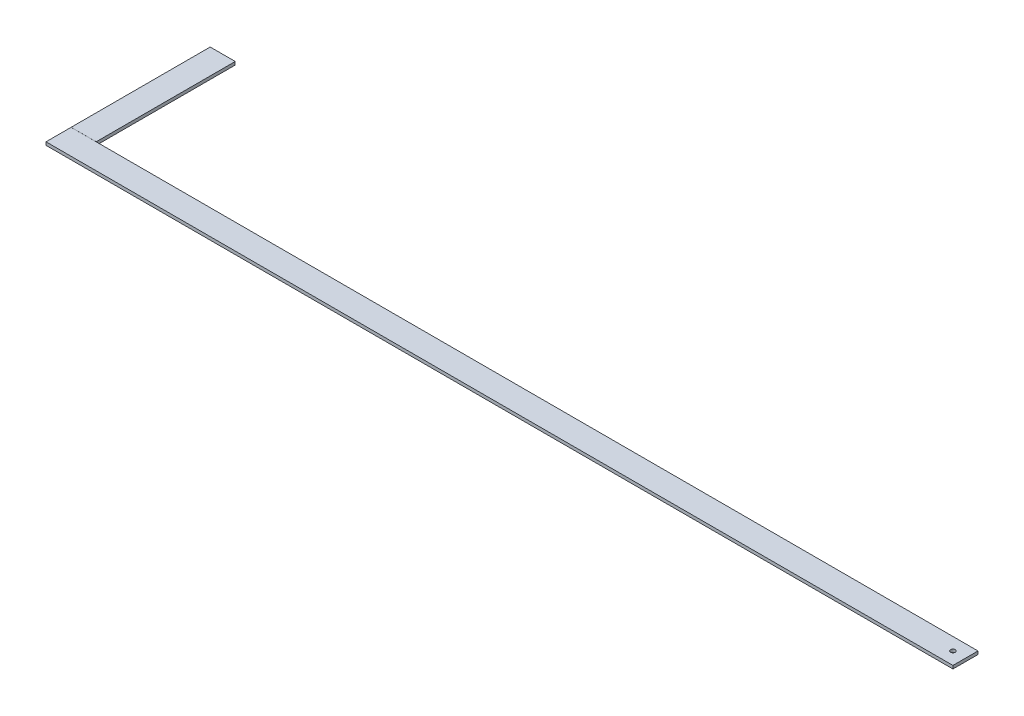
from build123d import *

# Parameters (mm, degrees)
CROQUIS2_W              = 50.8
CROQUIS2_H              = 135
SALIENTE_EXTRUIR1_DEPTH = 6.31
CROQUIS3_W              = 50.8
CROQUIS3_H              = 6.31
SALIENTE_EXTRUIR2_DEPTH = 513.44
CROQUIS4_W              = 50.8
CROQUIS4_H              = 6.31
SALIENTE_EXTRUIR3_DEPTH = 1787.3
CROQUIS9_W              = 50.8
CROQUIS9_H              = 6.31
SALIENTE_EXTRUIR4_DEPTH = 98
CROQUIS12_R             = 5
CORTAR_EXTRUIR1_DEPTH   = 10
CORTAR_EXTRUIR2_DEPTH   = 73
CROQUIS16_W             = 47.2
CROQUIS16_H             = 68.495521413
CORTAR_EXTRUIR5_DEPTH   = 10
CROQUIS17_W             = 50.8
CROQUIS17_H             = 0.1
CORTAR_EXTRUIR6_DEPTH   = 50.8
CROQUIS18_W             = 50.8
CROQUIS18_H             = 0.1
CORTAR_EXTRUIR7_DEPTH   = 50.8
CROQUIS20_R             = 5
CORTAR_EXTRUIR9_DEPTH   = 33
CROQUIS25_R             = 4.7625
CORTAR_EXTRUIR13_DEPTH  = 50
CROQUIS29_W             = 50.8
CROQUIS29_H             = 6.31
SALIENTE_EXTRUIR5_DEPTH = 100
CORTAR_EXTRUIR17_DEPTH  = 68
CROQUIS33_W             = 50.8
CROQUIS33_H             = 187
CORTAR_EXTRUIR18_DEPTH  = 74
CORTAR_EXTRUIR19_DEPTH  = 121


with BuildPart() as part:
    # Croquis2 → Saliente-Extruir1 (new body)
    with BuildSketch(Plane.XY):
        Rectangle(CROQUIS2_W, CROQUIS2_H)
    extrude(amount=SALIENTE_EXTRUIR1_DEPTH)

    # Croquis3 → Saliente-Extruir2 (add)
    with BuildSketch(Plane.XY.offset(6.31)):
        with Locations((0, -64.345)):
            Rectangle(CROQUIS3_W, CROQUIS3_H)
    extrude(amount=SALIENTE_EXTRUIR2_DEPTH)

    # Croquis4 → Saliente-Extruir3 (add)
    with BuildSketch(Plane(origin=(25.4, 0, 0), x_dir=(0, 0, -1), z_dir=(1, 0, 0))):
        with Locations((-494.35, -64.345)):
            Rectangle(CROQUIS4_W, CROQUIS4_H)
    extrude(amount=SALIENTE_EXTRUIR3_DEPTH)

    # Barrer2: sweep along a curve in space
    with BuildLine() as barrer2_path:
        Line((1787.3, -64.345, 519.75), (1787.3, -64.345, 642.06))
        Line((1787.3, -64.345, 642.06), (1787.3, 66.675, 642.06))
        Line((1787.3, 66.675, 642.06), (1787.3, 66.675, 1436.06))
    # Croquis9 → Barrer2 (sweep)
    with BuildSketch(Plane.XY.offset(519.75)):
        with Locations((1787.3, -64.345)):
            Rectangle(CROQUIS9_W, CROQUIS9_H)
    sweep(path=barrer2_path.line, transition=Transition.RIGHT)

    # Croquis11 → Saliente-Extruir4 (add)
    with BuildSketch(Plane.ZY.offset(25.4)):
        Polygon((0, 67.5), (-31.60126178, 124.808722595), (-26.075659426, 127.855658535), (6.31, 67.5), align=None)
    extrude(amount=-SALIENTE_EXTRUIR4_DEPTH)

    # Croquis12 → Cortar-Extruir1 (cut)
    with BuildSketch(Plane(origin=(0, 69.83, 0), x_dir=(1, 0, 0), z_dir=(0, 1, 0))):
        with Locations(Location((1787.3, -1403.06, 0), (0, 0, 270))):
            Circle(CROQUIS12_R)
        with Locations(Location((1787.3, -1183.06, 0), (0, 0, 270))):
            Circle(CROQUIS12_R)
    extrude(amount=-CORTAR_EXTRUIR1_DEPTH, mode=Mode.SUBTRACT)

    # Croquis13 → Cortar-Extruir2 (cut)
    with BuildSketch(Plane(origin=(1812.7, 0, 0), x_dir=(0, 0, -1), z_dir=(1, 0, 0))):
        Polygon((-645.215, 56.71628726), (-638.905, 56.71628726), (-638.905, 69.83), (-1436.06, 69.83), (-1436.06, 63.52), (-645.215, 63.52), align=None)
    extrude(amount=-CORTAR_EXTRUIR2_DEPTH, mode=Mode.SUBTRACT)

    # Croquis16 → Cortar-Extruir5 (cut)
    with BuildSketch(Plane(origin=(0, 17.718759704, 33.021634554), x_dir=(1, 0, 0), z_dir=(0, 0.47281426227300877, 0.8811621152723433))):
        with Locations((49, 90.742745493)):
            Rectangle(CROQUIS16_W, CROQUIS16_H)
    extrude(amount=-CORTAR_EXTRUIR5_DEPTH, mode=Mode.SUBTRACT)

    # Croquis17 → Cortar-Extruir6 (cut)
    with BuildSketch(Plane(origin=(0, -61.19, 0), x_dir=(1, 0, 0), z_dir=(0, 1, 0))):
        with Locations((0, -468.9)):
            Rectangle(CROQUIS17_W, CROQUIS17_H)
    extrude(amount=-CORTAR_EXTRUIR6_DEPTH, mode=Mode.SUBTRACT)


with BuildPart() as cortar_extruir6_piece_1:
    # of the separate pieces the step leaves, piece 1, a body of its own (cortar_extruir6_pieces)
    add(part.part.solids().sort_by_distance((-25.4, -61.19, 468.95))[0])

    # Croquis18 → Cortar-Extruir7 (cut)
    with BuildSketch(Plane(origin=(0, -61.19, 0), x_dir=(1, 0, 0), z_dir=(0, 1, 0))):
        with Locations((1787.3, -519.8)):
            Rectangle(CROQUIS18_W, CROQUIS18_H)
    extrude(amount=-CORTAR_EXTRUIR7_DEPTH, mode=Mode.SUBTRACT)


with BuildPart() as cortar_extruir6_piece_2:
    # of the separate pieces the step leaves, piece 2, a body of its own (cortar_extruir6_pieces)
    add(part.part.solids().sort_by_distance((-25.4, -61.19, 6.31))[0])

    # Croquis32 → Cortar-Extruir17 (cut)
    with BuildSketch(Plane.ZY.offset(25.4)):
        Polygon((6.31, -61.19), (0, -61.19), (0, 67.5), (-31.60126178, 124.808722595), (-26.075659426, 127.855658535), (6.31, 67.5), align=None)
    extrude(amount=-CORTAR_EXTRUIR17_DEPTH, mode=Mode.SUBTRACT)

    # Croquis33 → Cortar-Extruir18 (cut)
    with BuildSketch(Plane(origin=(0, -61.19, 0), x_dir=(1, 0, 0), z_dir=(0, 1, 0))):
        with Locations((0, -93.5)):
            Rectangle(CROQUIS33_W, CROQUIS33_H)
    extrude(amount=-CORTAR_EXTRUIR18_DEPTH, mode=Mode.SUBTRACT)


with BuildPart() as cortar_extruir7_piece_1:
    # of the separate pieces the step leaves, piece 1, a body of its own (cortar_extruir7_pieces)
    add(cortar_extruir6_piece_1.part.solids().sort_by_distance((-25.4, -61.19, 468.95))[0])

    # Croquis25 → Cortar-Extruir13 (cut)
    with BuildSketch(Plane(origin=(0, -67.5, 0), x_dir=(-1, 0, 0), z_dir=(0, -1, 0))):
        with Locations(Location((-1787.3, -494.35, 0), (0, 0, 90))):
            Circle(CROQUIS25_R)
    extrude(amount=-CORTAR_EXTRUIR13_DEPTH, mode=Mode.SUBTRACT)


with BuildPart() as cortar_extruir7_piece_2:
    # of the separate pieces the step leaves, piece 2, a body of its own (cortar_extruir7_pieces)
    add(cortar_extruir6_piece_1.part.solids().sort_by_distance((1812.7, -61.19, 638.905))[0])

    # Croquis20 → Cortar-Extruir9 (cut)
    with BuildSketch(Plane(origin=(0, 0, 638.905), x_dir=(-1, 0, 0), z_dir=(0, 0, -1))):
        with Locations((-1787.3, 22.71628726)):
            Circle(CROQUIS20_R)
    extrude(amount=-CORTAR_EXTRUIR9_DEPTH, mode=Mode.SUBTRACT)

    # Croquis29 → Saliente-Extruir5 (add)
    with BuildSketch(Plane(origin=(0, 56.71628726, 0), x_dir=(1, 0, 0), z_dir=(0, 1, 0))):
        with Locations((1787.3, -642.06)):
            Rectangle(CROQUIS29_W, CROQUIS29_H)
    extrude(amount=SALIENTE_EXTRUIR5_DEPTH)

    # Croquis34 → Cortar-Extruir19 (cut)
    with BuildSketch(Plane(origin=(1812.7, 0, 0), x_dir=(0, 0, -1), z_dir=(1, 0, 0))):
        Polygon((-519.85, -61.19), (-519.85, -67.5), (-645.215, -67.5), (-645.215, 156.71628726), (-638.905, 156.71628726), (-638.905, -61.19), align=None)
    extrude(amount=-CORTAR_EXTRUIR19_DEPTH, mode=Mode.SUBTRACT)


solid = Compound([cortar_extruir6_piece_2.part, cortar_extruir7_piece_1.part])
